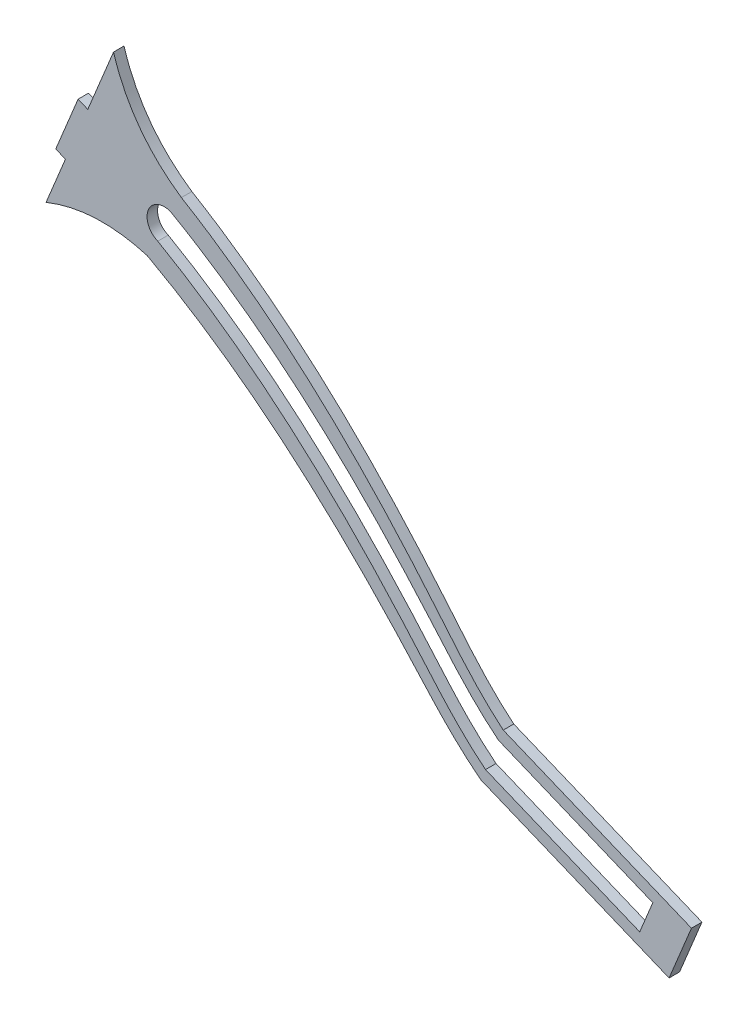
from build123d import *

# Parameters (mm, degrees)
BOSS_EXTRUDE1_DEPTH = 5


with BuildPart() as part:
    # Sketch2 → Boss-Extrude1 (new body)
    with BuildSketch(Plane.XY.offset(324.609115736)):
        with BuildLine():
            Line((-16.90012844, -8.183190187), (72.816503584, -45.112441184))
            Line((72.816503584, -45.112441184), (83.47431689, -19.220144733))
            Line((83.47431689, -19.220144733), (-6.242315134, 17.709106264))
            add(Edge.make_bspline(
                [(-6.242315134, 17.709106264), (-19.147085678, 28.427579084), (-62.609683594, 83.624540664), (-113.341454038, 133.123455083), (-159.667254415, 160.823469136)],
                knots=[0, 0, 0, 0, 0.237148473, 1, 1, 1, 1], degree=3))
            add(Edge.make_bspline(
                [(-192.022205471, 204.724702407), (-183.525718419, 177.076811357), (-159.667254415, 160.823469136)],
                knots=[0, 0, 0, 1, 1, 1], degree=2))
            Line((-192.022205471, 204.724702407), (-204.287606756, 174.926900827))
            Line((-204.287606756, 174.926900827), (-208.911231122, 176.830081774))
            Line((-208.911231122, 176.830081774), (-219.569044429, 150.937785322))
            Line((-219.569044429, 150.937785322), (-214.945420062, 149.034604375))
            Line((-214.945420062, 149.034604375), (-224.18290752, 126.592874832))
            add(Edge.make_bspline(
                [(-175.911850273, 128.697068335), (-200.797987469, 136.066038881), (-224.18290752, 126.592874832)],
                knots=[0, 0, 0, 1, 1, 1], degree=2))
            add(Edge.make_bspline(
                [(-16.90012844, -8.183190187), (-30.222192507, 2.01197393), (-75.852029724, 55.431258283), (-128.517955825, 102.867060046), (-175.911850273, 128.697068335)],
                knots=[0, 0, 0, 0, 0.237148473, 1, 1, 1, 1], degree=3))
        make_face()
        with BuildLine():
            Line((65.049758472, -17.908345143), (-8.450005033, 12.345702))
            add(Edge.make_bspline(
                [(-8.450005033, 12.345702), (-21.566591824, 22.803900379), (-66.124581019, 77.120450197), (-117.836312175, 125.594689972), (-164.70691842, 152.362521961)],
                knots=[0, 0, 0, 0, 0.237148473, 1, 1, 1, 1], degree=3))
            ThreePointArc((-164.70691842, 152.362521961), (-175.410879134, 147.900994755), (-170.949351927, 137.19703404))
            add(Edge.make_bspline(
                [(-14.692438541, -2.819785922), (-27.809025332, 7.638412457), (-72.367014526, 61.954962275), (-124.078745683, 110.429202051), (-170.949351927, 137.19703404)],
                knots=[0, 0, 0, 0, 0.237148473, 1, 1, 1, 1], degree=3))
            Line((-14.692438541, -2.819785922), (58.807324964, -33.073833065))
            Line((58.807324964, -33.073833065), (65.049758472, -17.908345143))
        make_face(mode=Mode.SUBTRACT)
    extrude(amount=-BOSS_EXTRUDE1_DEPTH)


solid = part.part
